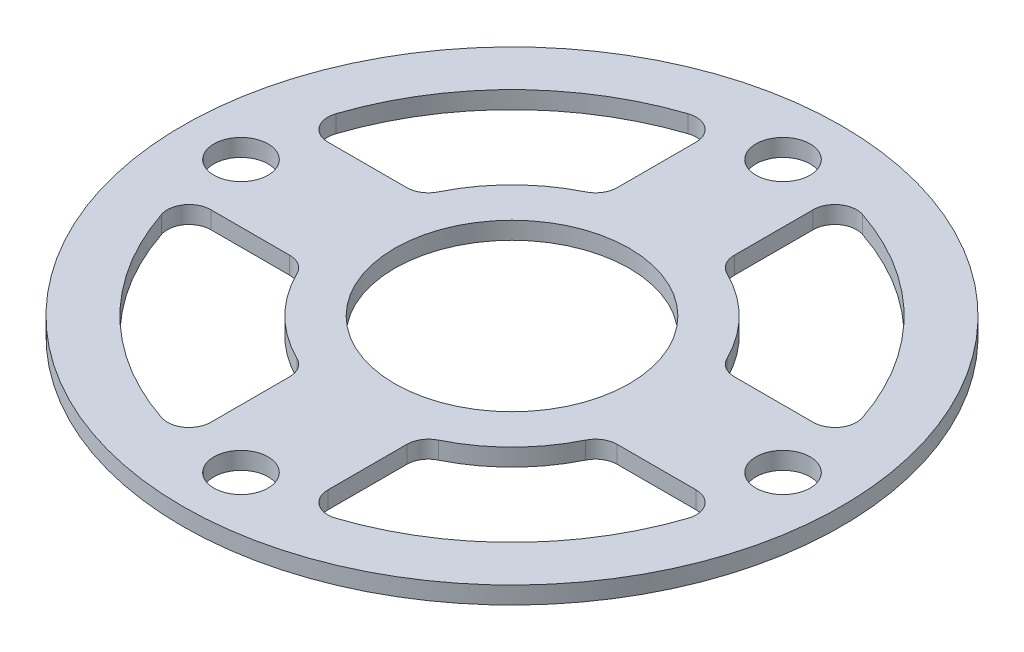
from build123d import *

# Parameters (mm, degrees)
SKETCH1_R           = 76
SKETCH1_R_2         = 27.051
SKETCH1_R_3         = 6.25
BOSS_EXTRUDE1_DEPTH = 4
CUT_EXTRUDE2_DEPTH  = 108.554637278
FILLET1_R           = 5


with BuildPart() as part:
    # Sketch1 → Boss-Extrude1 (new body)
    with BuildSketch(Plane(origin=(0, 0, 0), x_dir=(1, 0, 0), z_dir=(0, 1, 0))):
        with Locations(Location((0, 0, 0), (0, 0, 270))):
            Circle(SKETCH1_R)
        with Locations(Location((0, 0, 0), (0, 0, 270))):
            Circle(SKETCH1_R_2, mode=Mode.SUBTRACT)
        with Locations(Location((0, 62.5, 0), (0, 0, 270))):
            Circle(SKETCH1_R_3, mode=Mode.SUBTRACT)
        with Locations(Location((62.5, 0, 0), (0, 0, 270))):
            Circle(SKETCH1_R_3, mode=Mode.SUBTRACT)
        with Locations(Location((0, -62.5, 0), (0, 0, 270))):
            Circle(SKETCH1_R_3, mode=Mode.SUBTRACT)
        with Locations(Location((-62.5, 0, 0), (0, 0, 270))):
            Circle(SKETCH1_R_3, mode=Mode.SUBTRACT)
    extrude(amount=BOSS_EXTRUDE1_DEPTH)

    # Sketch4 → Cut-Extrude2 (cut, through all)
    with BuildSketch(Plane(origin=(0, 4, 0), x_dir=(1, 0, 0), z_dir=(0, 1, 0))):
        with BuildLine():
            ThreePointArc((-34.504008477, 13.5), (-26.19901335, 26.19901335), (-13.5, 34.504008477))
            Line((-13.5, 34.504008477), (-13.5, 62.5))
            ThreePointArc((-13.5, 62.5), (-45.213382975, 45.213382975), (-62.5, 13.5))
            Line((-62.5, 13.5), (-34.504008477, 13.5))
        make_face()
        with BuildLine():
            ThreePointArc((62.5, 13.5), (45.213382975, 45.213382975), (13.5, 62.5))
            Line((13.5, 62.5), (13.5, 34.504008477))
            ThreePointArc((13.5, 34.504008477), (26.19901335, 26.19901335), (34.504008477, 13.5))
            Line((34.504008477, 13.5), (62.5, 13.5))
        make_face()
        with BuildLine():
            Line((62.5, -13.5), (34.504008477, -13.5))
            ThreePointArc((34.504008477, -13.5), (26.19901335, -26.19901335), (13.5, -34.504008477))
            Line((13.5, -34.504008477), (13.5, -62.5))
            ThreePointArc((13.5, -62.5), (45.213382975, -45.213382975), (62.5, -13.5))
        make_face()
        with BuildLine():
            ThreePointArc((-13.5, -34.504008477), (-26.19901335, -26.19901335), (-34.504008477, -13.5))
            Line((-34.504008477, -13.5), (-62.5, -13.5))
            ThreePointArc((-62.5, -13.5), (-45.213382975, -45.213382975), (-13.5, -62.5))
            Line((-13.5, -62.5), (-13.5, -34.504008477))
        make_face()
    extrude(amount=-CUT_EXTRUDE2_DEPTH, mode=Mode.SUBTRACT)

    # Fillet1
    fillet1_edges = [part.edges().sort_by_distance(p)[0] for p in [
        (-34.504008477, 2, 13.5),
        (-13.5, 2, 34.504008477),
        (-13.5, 2, 62.5),
        (-62.5, 2, 13.5),
        (13.5, 2, 34.504008477),
        (34.504008477, 2, 13.5),
        (62.5, 2, 13.5),
        (13.5, 2, 62.5),
        (34.504008477, 2, -13.5),
        (13.5, 2, -34.504008477),
        (13.5, 2, -62.5),
        (62.5, 2, -13.5),
        (-13.5, 2, -34.504008477),
        (-34.504008477, 2, -13.5),
        (-62.5, 2, -13.5),
        (-13.5, 2, -62.5),
    ]]
    fillet(fillet1_edges, radius=FILLET1_R)


solid = part.part
